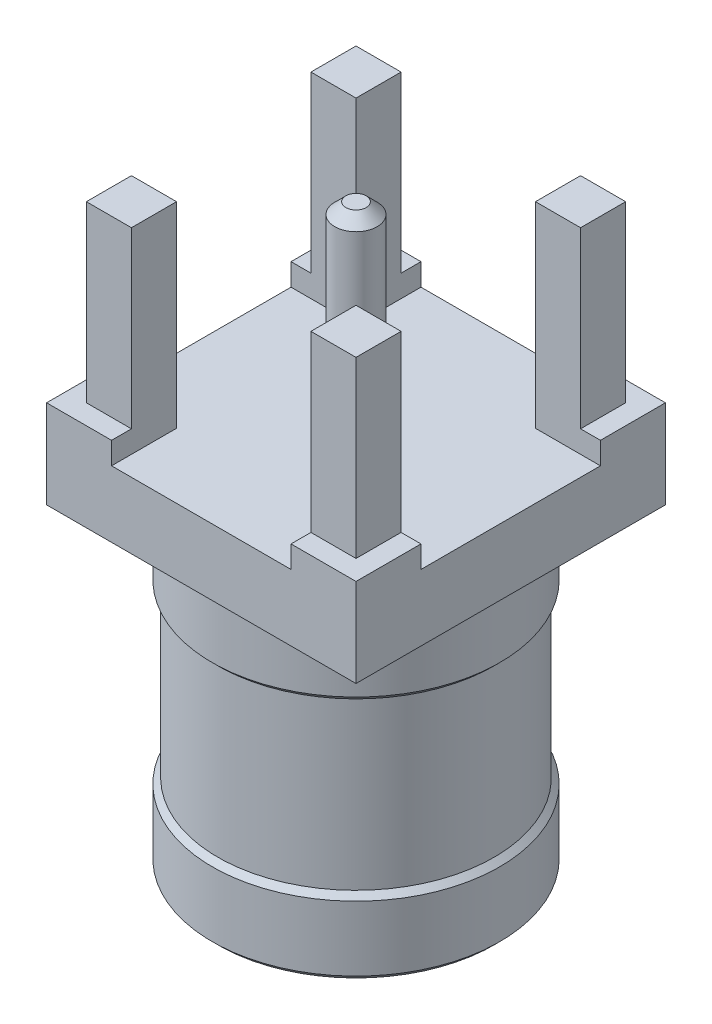
from build123d import *

# Parameters (mm, degrees)
SKETCH1_W           = 7
SKETCH1_H           = 7
BOSS_EXTRUDE1_DEPTH = 1.5
SKETCH2_W           = 1.47
SKETCH2_H           = 1.47
BOSS_EXTRUDE2_DEPTH = 0.5
SKETCH3_W           = 1.02
SKETCH3_H           = 1.02
BOSS_EXTRUDE3_DEPTH = 3.94
SKETCH4_R           = 3.25
SKETCH4_R_2         = 1.6
BOSS_EXTRUDE4_DEPTH = 7.06
CHAMFER1_SIZE       = 0.125
SKETCH7_R           = 0.48
BOSS_EXTRUDE5_DEPTH = 4.44
CHAMFER2_SIZE       = 0.25


with BuildPart() as part:
    # Sketch1 → Boss-Extrude1 (new body)
    with BuildSketch(Plane(origin=(0, 0, 0), x_dir=(1, 0, 0), z_dir=(0, 1, 0))):
        Rectangle(SKETCH1_W, SKETCH1_H)
    extrude(amount=BOSS_EXTRUDE1_DEPTH)

    # Sketch2 → Boss-Extrude2 (add)
    with BuildSketch(Plane(origin=(0, 1.5, 0), x_dir=(1, 0, 0), z_dir=(0, 1, 0))):
        with Locations((-2.765, 2.765)):
            Rectangle(SKETCH2_W, SKETCH2_H)
        with Locations((2.765, 2.765)):
            Rectangle(SKETCH2_W, SKETCH2_H)
        with Locations((2.765, -2.765)):
            Rectangle(SKETCH2_W, SKETCH2_H)
        with Locations((-2.765, -2.765)):
            Rectangle(SKETCH2_W, SKETCH2_H)
    extrude(amount=BOSS_EXTRUDE2_DEPTH)

    # Sketch3 → Boss-Extrude3 (add)
    with BuildSketch(Plane(origin=(0, 2, 0), x_dir=(1, 0, 0), z_dir=(0, 1, 0))):
        with Locations((-2.54, -2.54)):
            Rectangle(SKETCH3_W, SKETCH3_H)
        with Locations((2.54, -2.54)):
            Rectangle(SKETCH3_W, SKETCH3_H)
        with Locations((2.54, 2.54)):
            Rectangle(SKETCH3_W, SKETCH3_H)
        with Locations((-2.54, 2.54)):
            Rectangle(SKETCH3_W, SKETCH3_H)
    extrude(amount=BOSS_EXTRUDE3_DEPTH)

    # Sketch4 → Boss-Extrude4 (add)
    with BuildSketch(Plane.XZ):
        with Locations(Location((0, 0, 0), (0, 0, 270))):
            Circle(SKETCH4_R)
        with Locations(Location((0, 0, 0), (0, 0, 270))):
            Circle(SKETCH4_R_2, mode=Mode.SUBTRACT)
    extrude(amount=BOSS_EXTRUDE4_DEPTH)

    # Chamfer1
    chamfer1_edges = [part.edges().sort_by_distance(p)[0] for p in [
        (0, -7.06, 1.6),
        (0, -7.06, 3.25),
    ]]
    chamfer(chamfer1_edges, length=CHAMFER1_SIZE)

    # Sketch5 → Cut-Revolve1 (revolve, cut)
    with BuildSketch(Plane.XY, mode=Mode.PRIVATE) as cut_revolve1_sk:
        Polygon((-3.25, -1.4675), (-3.125, -1.5925), (-3.125, -5.3425), (-3.25, -5.4675), align=None)
        Polygon((-3.25, 0), (-3.125, 0), (-3.25, -0.125), align=None)
    revolve(cut_revolve1_sk.sketch.rotate(Axis((0, -6.81, 0), (0, 1, 0)), 270), axis=Axis((0, -6.81, 0), (0, 1, 0)), mode=Mode.SUBTRACT)

    # Sketch7 → Boss-Extrude5 (add)
    with BuildSketch(Plane(origin=(0, 1.5, 0), x_dir=(1, 0, 0), z_dir=(0, 1, 0))):
        with Locations(Location((0, 0, 0), (0, 0, 90))):
            Circle(SKETCH7_R)
    extrude(amount=BOSS_EXTRUDE5_DEPTH)

    # Chamfer2
    chamfer2_edges = [part.edges().sort_by_distance(p)[0] for p in [
        (0, 5.94, 0.48),
    ]]
    chamfer(chamfer2_edges, length=CHAMFER2_SIZE)


solid = part.part
